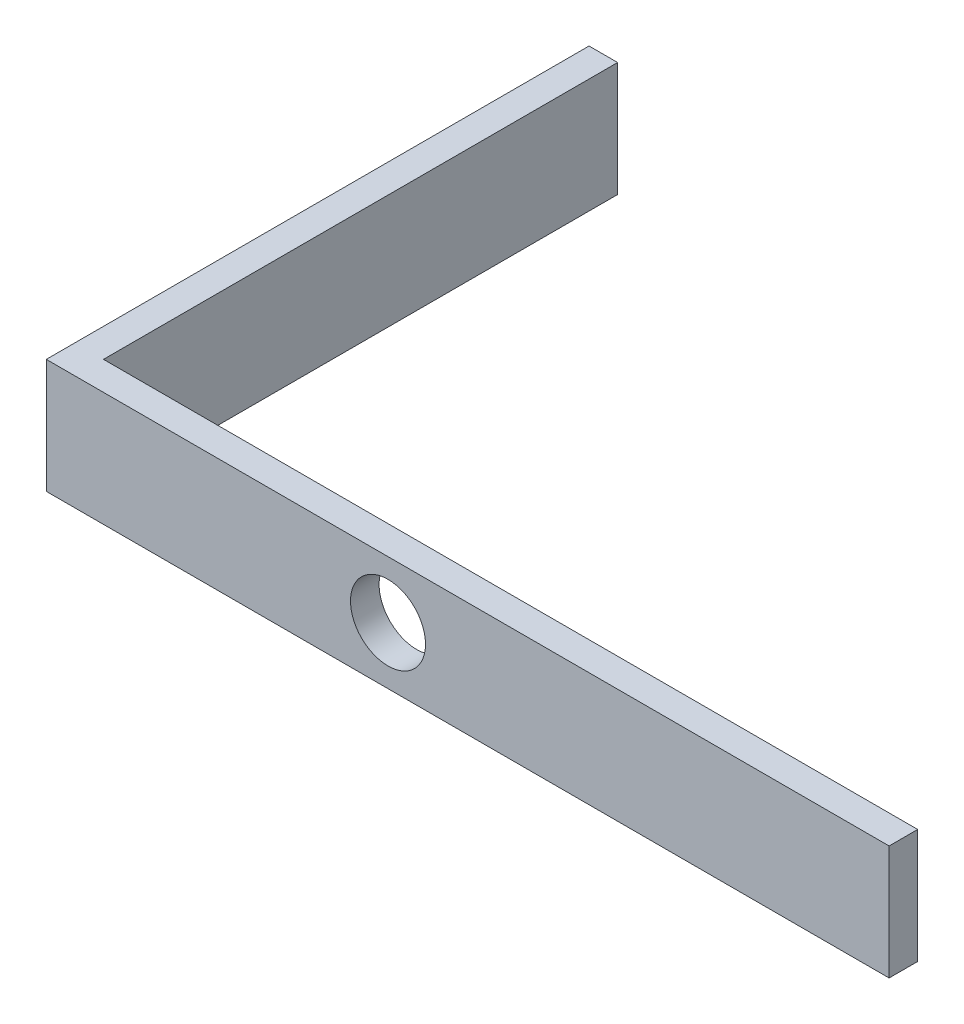
from build123d import *

# Parameters (mm, degrees)
BOSS_EXTRUDE1_DEPTH = 7.9375
SKETCH2_R           = 5.207
CUT_EXTRUDE1_DEPTH  = 3.96875


with BuildPart() as part:
    # Sketch1 → Boss-Extrude1 (new, symmetric)
    with BuildSketch(Plane(origin=(0, 0, 0), x_dir=(1, 0, 0), z_dir=(0, 1, 0))):
        Polygon((0, 0), (3.96875, 0), (116.99875, 0), (116.99875, 3.96875), (3.96875, 3.96875), (3.96875, 75.34275), (0, 75.34275), align=None)
    extrude(amount=BOSS_EXTRUDE1_DEPTH, both=True)

    # Sketch2 → Cut-Extrude1 (cut)
    with BuildSketch(Plane.XY):
        with Locations((47.4345, 0)):
            Circle(SKETCH2_R)
    extrude(amount=-CUT_EXTRUDE1_DEPTH, mode=Mode.SUBTRACT)


solid = part.part
